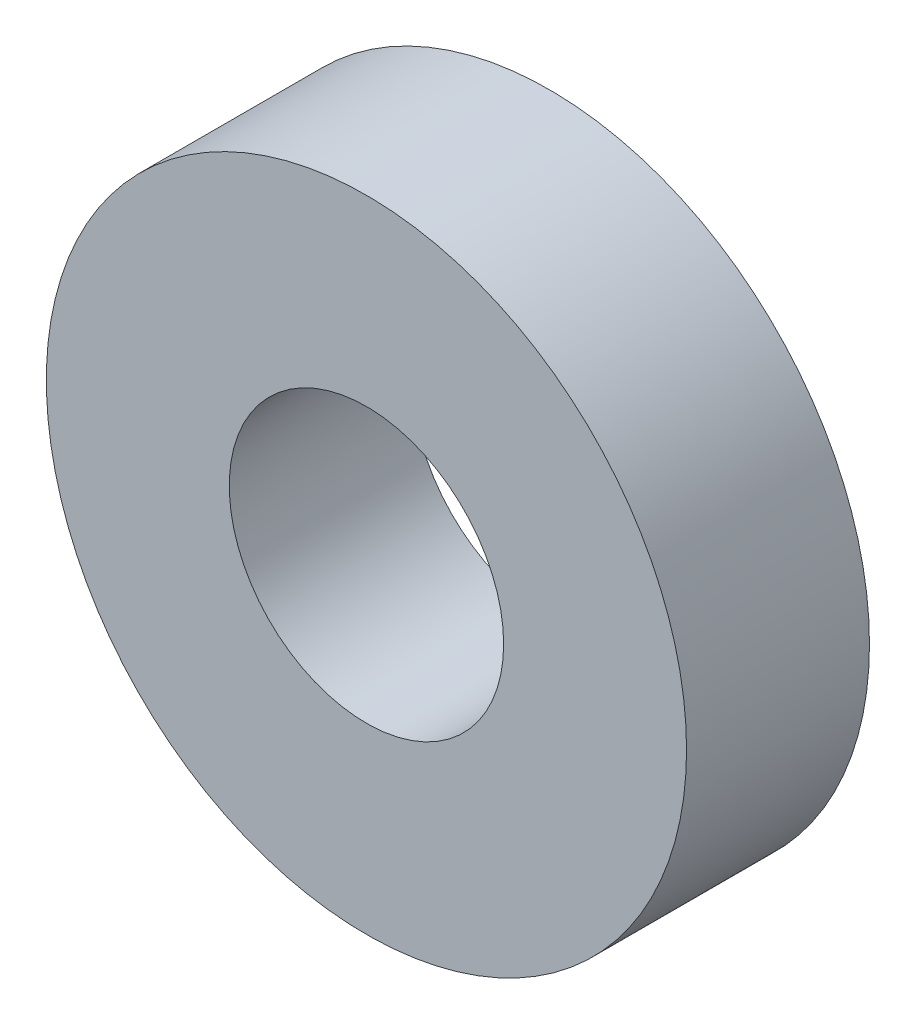
from build123d import *

# Parameters (mm, degrees)
SKETCH1_R           = 4.445
SKETCH1_R_2         = 1.905
BOSS_EXTRUDE1_DEPTH = 2.54


with BuildPart() as part:
    # Sketch1 → Boss-Extrude1 (new body)
    with BuildSketch(Plane.XY):
        Circle(SKETCH1_R)
        Circle(SKETCH1_R_2, mode=Mode.SUBTRACT)
    extrude(amount=BOSS_EXTRUDE1_DEPTH)


solid = part.part
